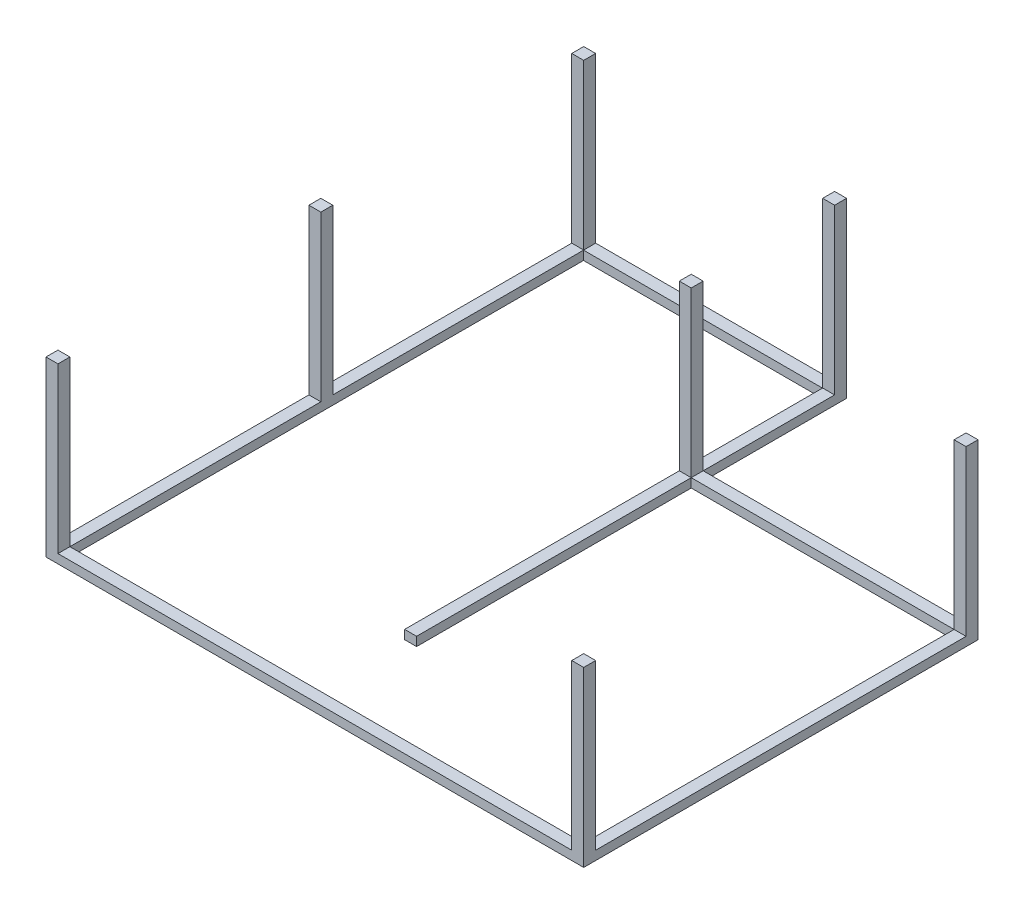
from build123d import *

# Parameters (mm, degrees)
EXTRUDE_1_DEPTH = 150
SKETCH_2_W      = 200
SKETCH_2_H      = 200
EXTRUDE_2_DEPTH = 2750


with BuildPart() as part:
    # Эскиз1 → Бобышка-Вытянуть1 (new body)
    with BuildSketch(Plane.XZ):
        Polygon((0, 0), (9000, 0), (9000, -6600), (4400, -6600), (4400, -9000), (0, -9000), align=None)
        Polygon((200, -200), (8800, -200), (8800, -6400), (4400, -6400), (4400, -1803), (4200, -1803), (4200, -8797), (200, -8797), align=None, mode=Mode.SUBTRACT)
    extrude(amount=EXTRUDE_1_DEPTH)

    # Эскиз2 → Бобышка-Вытянуть2 (add)
    with BuildSketch(Plane(origin=(0, 0, 0), x_dir=(1, 0, 0), z_dir=(0, 1, 0))):
        with Locations((100, 8900)):
            Rectangle(SKETCH_2_W, SKETCH_2_H)
        with Locations((4300, 8900)):
            Rectangle(SKETCH_2_W, SKETCH_2_H)
        with Locations((4300, 6500)):
            Rectangle(SKETCH_2_W, SKETCH_2_H)
        with Locations((8900, 6500)):
            Rectangle(SKETCH_2_W, SKETCH_2_H)
        with Locations((8900, 100)):
            Rectangle(SKETCH_2_W, SKETCH_2_H)
        with Locations((100, 100)):
            Rectangle(SKETCH_2_W, SKETCH_2_H)
        with Locations((100, 4500)):
            Rectangle(SKETCH_2_W, SKETCH_2_H)
    extrude(amount=EXTRUDE_2_DEPTH)


solid = part.part
